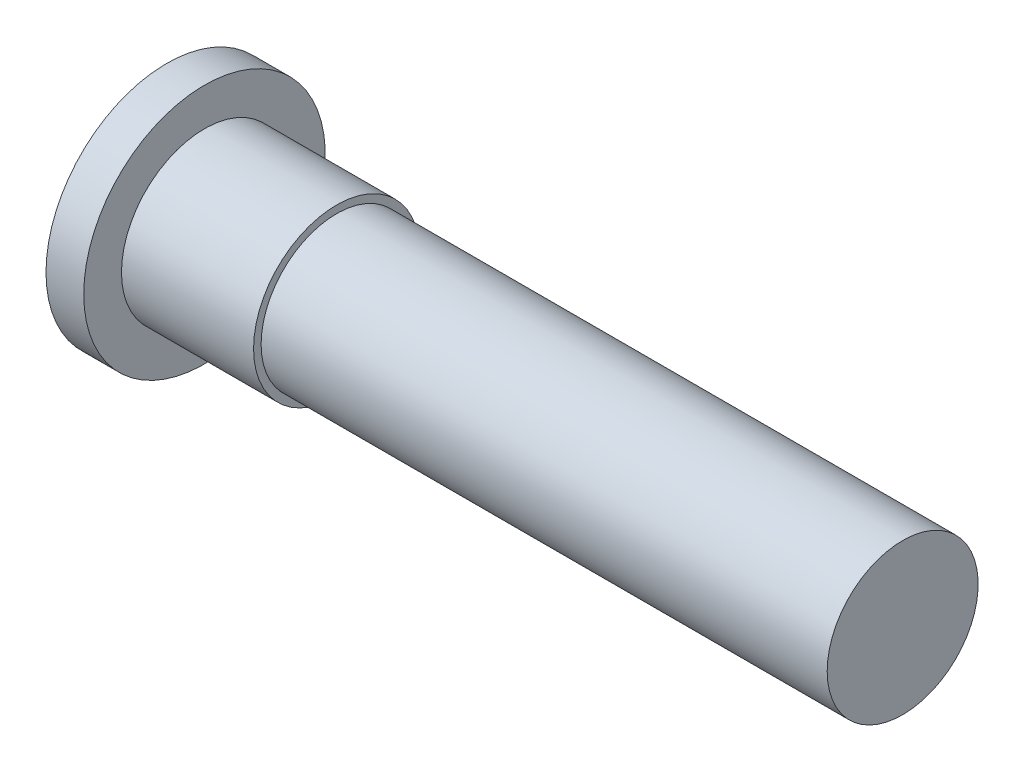
from build123d import *


with BuildPart() as part:
    # 草图1 → 旋转1 (revolve)
    with BuildSketch(Plane(origin=(0, 0, 0), x_dir=(1, 0, 0), z_dir=(0, 1, 0)), mode=Mode.PRIVATE) as revolve_1_sk:
        Polygon((0, 0), (0, 16), (5, 16), (5, 11), (22.5, 11), (22.5, 10), (97.5, 10), (97.5, 0), align=None)
    revolve(revolve_1_sk.sketch.rotate(Axis((-110.729499132, 0, 0), (1, 0, 0)), 180), axis=Axis((-110.729499132, 0, 0), (1, 0, 0)))


solid = part.part
